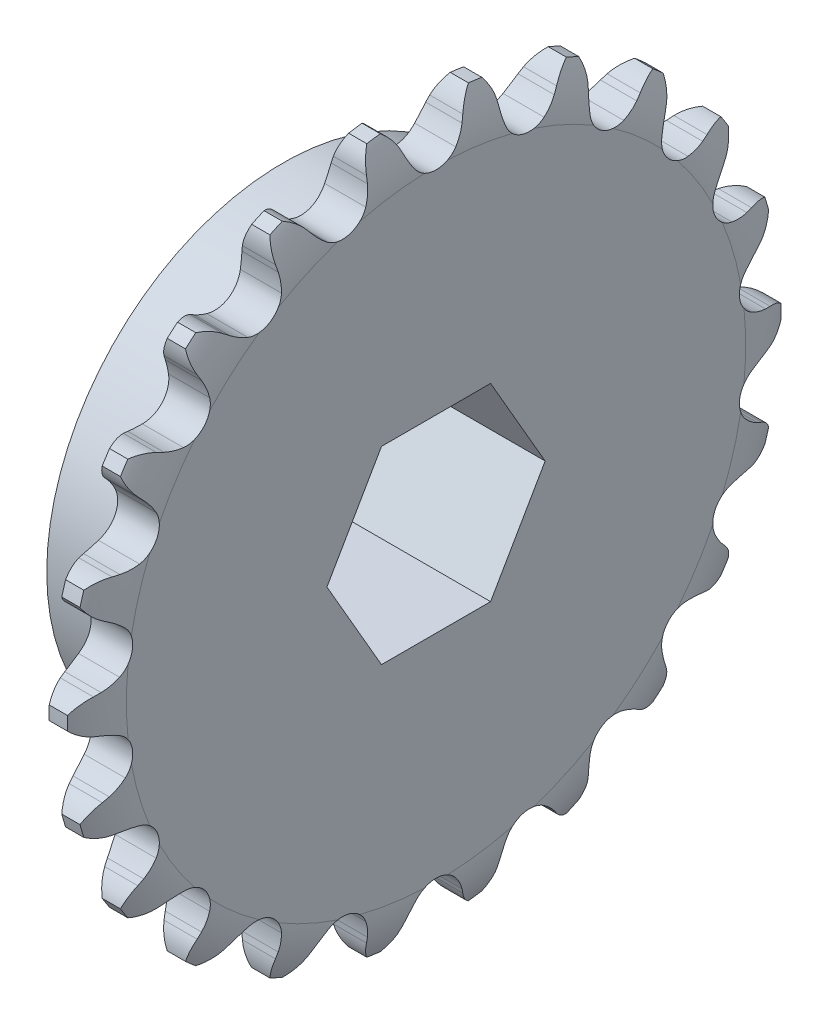
from build123d import *

# Parameters (mm, degrees)
TOOTHCUT_DEPTH     = 35.038989915
TEETHCUTS_COUNT    = 22
TEETHCUTS_ANGLE    = 343.636363636
HUBNEAONESKE_R     = 15.875
HUBNEARONE_DEPTH   = 7.4867008
BORSKE_R           = 4.7625
BORE_DEPTH         = 10.2870508
CUT_EXTRUDE1_DEPTH = 36.325169553


with BuildPart() as part:
    # BasProSke → Base-Revolve (revolve)
    with BuildSketch(Plane(origin=(0, 0, 0), x_dir=(1, 0, 0), z_dir=(0, 1, 0)), mode=Mode.PRIVATE) as base_revolve_sk:
        with BuildLine():
            Line((0, 0), (0, 20.812610076))
            ThreePointArc((0, 20.812610076), (0.199787117, 22.448200471), (0.7874, 23.987610076))
            Line((0.7874, 23.987610076), (2.01295, 23.987610076))
            ThreePointArc((2.01295, 23.987610076), (2.600562883, 22.448200471), (2.80035, 20.812610076))
            Line((2.80035, 20.812610076), (2.80035, 0))
            Line((2.80035, 0), (0, 0))
        make_face()
    revolve(base_revolve_sk.sketch.rotate(Axis((-10, 0, 0), (1, 0, 0)), 180), axis=Axis((-10, 0, 0), (1, 0, 0)))

    # TooCutSke → ToothCut (cut, through all)
    with BuildSketch(Plane(origin=(0, 0, 0), x_dir=(0, 0, -1), z_dir=(1, 0, 0))):
        with BuildLine():
            Line((1.925899669, 22.281562943), (2.085675584, 22.671665687))
            ThreePointArc((2.085675584, 22.671665687), (3.076365157, 23.886174382), (4.575746562, 24.342630953))
            ThreePointArc((4.575746562, 24.342630953), (0, 24.768955131), (-4.575746562, 24.342630953))
            ThreePointArc((-4.575746562, 24.342630953), (-3.076365157, 23.886174382), (-2.085675584, 22.671665687))
            Line((-2.085675584, 22.671665687), (-1.925899669, 22.281562943))
            ThreePointArc((-1.925899669, 22.281562943), (-1.668318341, 21.756617587), (-1.342492991, 21.271072935))
            ThreePointArc((-1.342492991, 21.271072935), (0, 20.612335557), (1.342492991, 21.271072935))
            ThreePointArc((1.342492991, 21.271072935), (1.668318341, 21.756617587), (1.925899669, 22.281562943))
        make_face()
    toothcut = extrude(amount=TOOTHCUT_DEPTH, mode=Mode.SUBTRACT)

    # TeethCuts: ToothCut ×22 about axis
    teethcuts_axis = Axis((-10, 0, 0), (1, 0, 0))
    for i in range(1, TEETHCUTS_COUNT):
        add(toothcut.rotate(teethcuts_axis, i * TEETHCUTS_ANGLE / (TEETHCUTS_COUNT - 1)), mode=Mode.SUBTRACT)

    # HubNeaOneSke → HubNearOne (add)
    with BuildSketch(Plane.ZY):
        with Locations(Location((0, 0, 0), (0, 0, 180))):
            Circle(HUBNEAONESKE_R)
    extrude(amount=HUBNEARONE_DEPTH)

    # BorSke → Bore (cut, symmetric)
    with BuildSketch(Plane(origin=(0, 0, 0), x_dir=(0, 0, -1), z_dir=(1, 0, 0))):
        with Locations(Location((0, 0, 0), (0, 0, 180))):
            Circle(BORSKE_R)
    extrude(amount=BORE_DEPTH, both=True, mode=Mode.SUBTRACT)

    # Sketch1 → Cut-Extrude1 (cut, through all)
    with BuildSketch(Plane.ZY.offset(7.4867008)):
        Polygon((-7.332348419, 0), (-3.666174209, -6.35), (3.666174209, -6.35), (7.332348419, 0), (3.666174209, 6.35), (-3.666174209, 6.35), align=None)
    extrude(amount=-CUT_EXTRUDE1_DEPTH, mode=Mode.SUBTRACT)


solid = part.part
